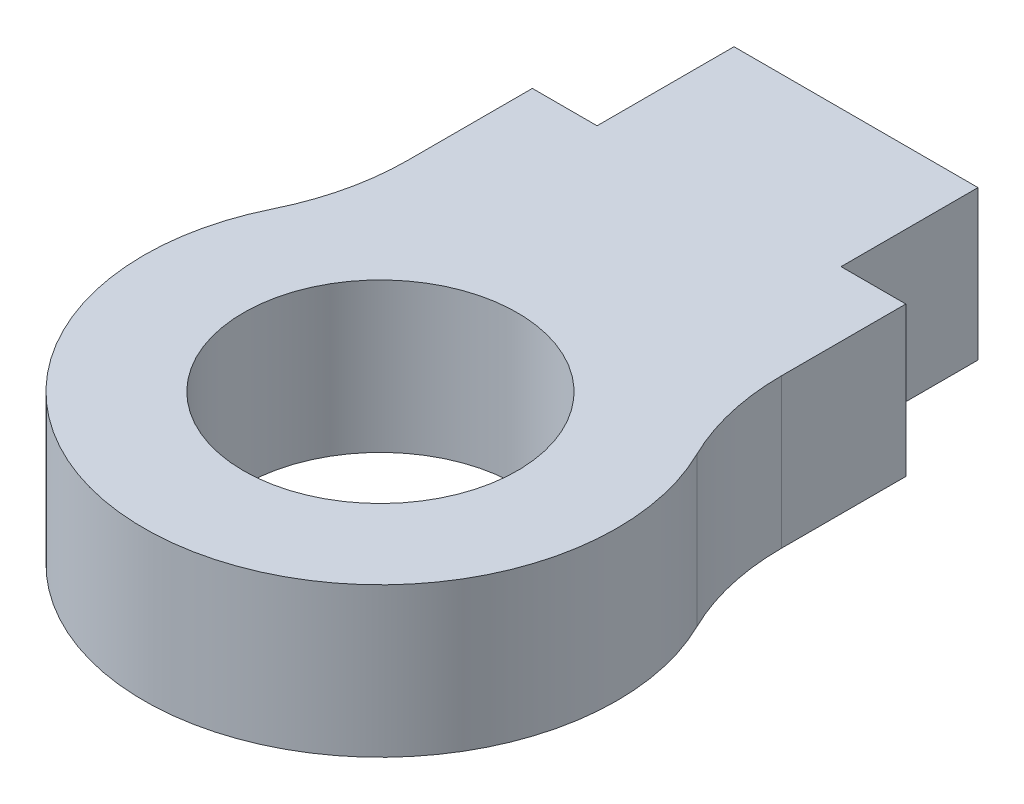
from build123d import *

# Parameters (mm, degrees)
SKETCH1_R           = 5.5
BOSS_EXTRUDE1_DEPTH = 6


with BuildPart() as part:
    # Sketch1 → Boss-Extrude1 (new body)
    with BuildSketch(Plane(origin=(0, 0, 0), x_dir=(1, 0, 0), z_dir=(0, 1, 0))):
        with BuildLine():
            Line((7.5, 8.602325267), (7.5, 13.602325267))
            Line((7.5, 13.602325267), (4.9, 13.602325267))
            Line((4.9, 13.602325267), (4.9, 19.102325267))
            Line((4.9, 19.102325267), (-4.9, 19.102325267))
            Line((-4.9, 19.102325267), (-4.9, 13.602325267))
            Line((-4.9, 13.602325267), (-7.5, 13.602325267))
            Line((-7.5, 13.602325267), (-7.5, 8.602325267))
            ThreePointArc((-7.5, 8.602325267), (-7.75978466, 6.337771199), (-8.525641026, 4.190876412))
            ThreePointArc((-8.525641026, 4.190876412), (0, -9.5), (8.525641026, 4.190876412))
            ThreePointArc((8.525641026, 4.190876412), (7.75978466, 6.337771199), (7.5, 8.602325267))
        make_face()
        with Locations(Location((0, 0, 0), (0, 0, 270))):
            Circle(SKETCH1_R, mode=Mode.SUBTRACT)
    extrude(amount=BOSS_EXTRUDE1_DEPTH)


solid = part.part
